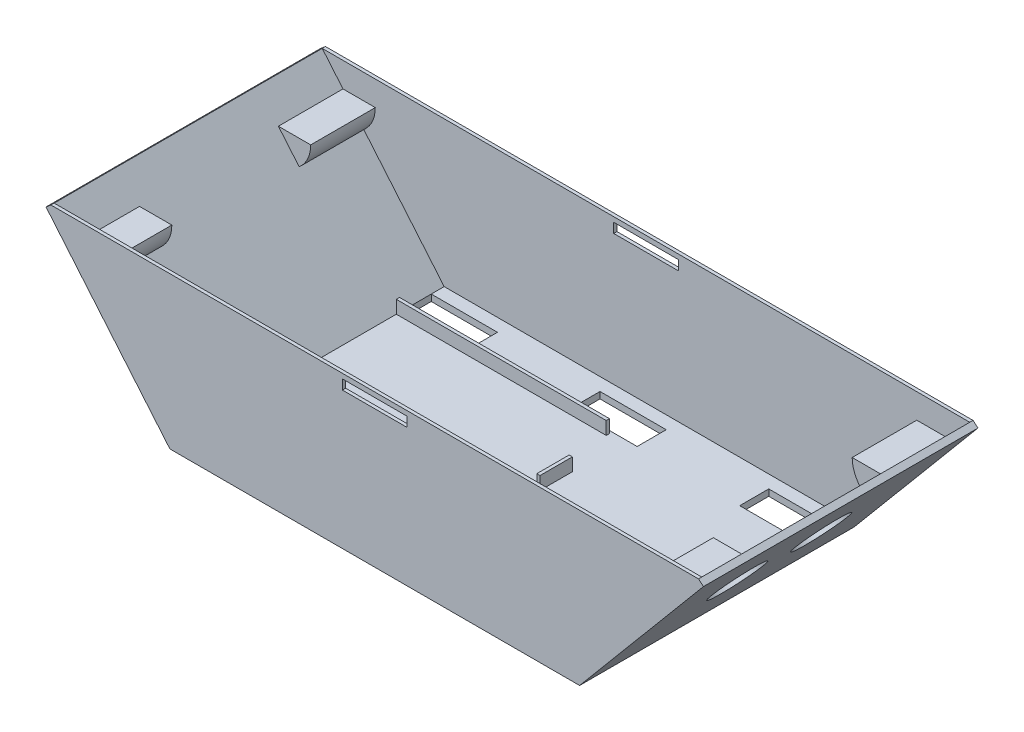
from build123d import *

# Parameters (mm, degrees)
EXTRU_MINCE1_DEPTH      = 85
BOSS_EXTRU_1_DEPTH      = 1
BOSS_EXTRU_2_DEPTH      = 1
ESQUISSE7_W             = 20
ESQUISSE7_H             = 10
R_VOL_MINCE1_ANGLE      = 50
ESQUISSE8_W             = 20
ESQUISSE8_H             = 10
R_VOL_MINCE2_ANGLE      = 50
ESQUISSE9_W             = 20
ESQUISSE9_H             = 10
R_VOL_MINCE3_ANGLE      = 50
ESQUISSE10_W            = 20
ESQUISSE10_H            = 10
R_VOL_MINCE4_ANGLE      = 50
ESQUISSE12_W            = 20.5
ESQUISSE12_H            = 9
ENL_V_MAT_EXTRU_2_DEPTH = 10
ESQUISSE13_W            = 20.5
ESQUISSE13_H            = 9
ENL_V_MAT_EXTRU_3_DEPTH = 10
ESQUISSE14_W            = 65
ESQUISSE14_H            = 1
EXTRU_MINCE2_DEPTH      = 4
ESQUISSE15_W            = 1
ESQUISSE15_H            = 10
EXTRU_MINCE3_DEPTH      = 4
ESQUISSE16_W            = 20
ESQUISSE16_H            = 3
ENL_V_MAT_EXTRU_4_DEPTH = 10
ESQUISSE17_W            = 20
ESQUISSE17_H            = 3
ENL_V_MAT_EXTRU_5_DEPTH = 10
ESQUISSE19_R            = 8.005
ENL_V_MAT_EXTRU_6_DEPTH = 10


with BuildPart() as part:
    # Esquisse3 → Extru.-Mince1 (new body)
    with BuildSketch(Plane.XY):
        Polygon((-37.759483403, 45), (0, 0), (125, 0), (162.759483403, 45), (164.291572289, 43.714424781), (125.932615316, -2), (-0.932615316, -2), (-39.291572289, 43.714424781), align=None)
    extrude(amount=EXTRU_MINCE1_DEPTH)

    # Esquisse5 → Boss.-Extru.1 (add)
    with BuildSketch(Plane(origin=(0, 0, 0), x_dir=(-1, 0, 0), z_dir=(0, 0, -1))):
        Polygon((-162.759483403, 45), (37.759483403, 45), (0, 0), (-125, 0), align=None)
    extrude(amount=-BOSS_EXTRU_1_DEPTH)

    # Esquisse6 → Boss.-Extru.2 (add)
    with BuildSketch(Plane.XY.offset(85)):
        Polygon((162.759483403, 45), (-37.759483403, 45), (0, 0), (125, 0), align=None)
    extrude(amount=-BOSS_EXTRU_2_DEPTH)

    # Esquisse7 → Révol.-Mince1 (revolve)
    with BuildSketch(Plane(origin=(0, 0, 0), x_dir=(0, 0, -1), z_dir=(0.7660444431189791, 0.642787609686538, 0))):
        with Locations((-74, 43.74332802)):
            Rectangle(ESQUISSE7_W, ESQUISSE7_H)
    revolve(axis=Axis((-31.331607306, 37.339555569, 84), (0, 0, 1)), revolution_arc=R_VOL_MINCE1_ANGLE)

    # Esquisse8 → Révol.-Mince2 (revolve)
    with BuildSketch(Plane(origin=(0, 0, 0), x_dir=(0, 0, -1), z_dir=(0.7660444431189791, 0.642787609686538, 0))):
        with Locations((-11, 43.74332802)):
            Rectangle(ESQUISSE8_W, ESQUISSE8_H)
    revolve(axis=Axis((-31.331607306, 37.339555569, 1), (0, 0, 1)), revolution_arc=R_VOL_MINCE2_ANGLE)

    # Esquisse9 → Révol.-Mince3 (revolve)
    with BuildSketch(Plane(origin=(73.353011104, -61.550484563, 0), x_dir=(0, 0, 1), z_dir=(-0.7660444431189796, 0.6427876096865375, 0))):
        with Locations((74, 124.091779231)):
            Rectangle(ESQUISSE9_W, ESQUISSE9_H)
    revolve(axis=Axis((156.331607306, 37.339555569, 84), (0, 0, -1)), revolution_arc=R_VOL_MINCE3_ANGLE)

    # Esquisse10 → Révol.-Mince4 (revolve)
    with BuildSketch(Plane(origin=(73.353011104, -61.550484563, 0), x_dir=(0, 0, 1), z_dir=(-0.7660444431189796, 0.6427876096865375, 0))):
        with Locations((11, 124.091779231)):
            Rectangle(ESQUISSE10_W, ESQUISSE10_H)
    revolve(axis=Axis((156.331607306, 37.339555569, 1), (0, 0, -1)), revolution_arc=R_VOL_MINCE4_ANGLE)

    # Esquisse12 → Enlèv. mat.-Extru.2 (cut)
    with BuildSketch(Plane(origin=(0, 0, 0), x_dir=(1, 0, 0), z_dir=(0, 1, 0))):
        with Locations((10.25, -9.5)):
            Rectangle(ESQUISSE12_W, ESQUISSE12_H)
        with Locations((10.25, -75.5)):
            Rectangle(ESQUISSE12_W, ESQUISSE12_H)
        with Locations((114.75, -9.5)):
            Rectangle(ESQUISSE12_W, ESQUISSE12_H)
        with Locations((114.75, -75.5)):
            Rectangle(ESQUISSE12_W, ESQUISSE12_H)
    extrude(amount=-ENL_V_MAT_EXTRU_2_DEPTH, mode=Mode.SUBTRACT)

    # Esquisse13 → Enlèv. mat.-Extru.3 (cut)
    with BuildSketch(Plane(origin=(0, 0, 0), x_dir=(1, 0, 0), z_dir=(0, 1, 0))):
        with Locations((62.5, -9.5)):
            Rectangle(ESQUISSE13_W, ESQUISSE13_H)
        with Locations((62.5, -75.5)):
            Rectangle(ESQUISSE13_W, ESQUISSE13_H)
    extrude(amount=-ENL_V_MAT_EXTRU_3_DEPTH, mode=Mode.SUBTRACT)

    # Esquisse14 → Extru.-Mince2 (add)
    with BuildSketch(Plane(origin=(0, 0, 0), x_dir=(1, 0, 0), z_dir=(0, 1, 0))):
        with Locations((32.5, -15.319657918)):
            Rectangle(ESQUISSE14_W, ESQUISSE14_H)
        with Locations((32.5, -68.819657918)):
            Rectangle(ESQUISSE14_W, ESQUISSE14_H)
    extrude(amount=EXTRU_MINCE2_DEPTH)

    # Esquisse15 → Extru.-Mince3 (add)
    with BuildSketch(Plane(origin=(0, 0, 0), x_dir=(1, 0, 0), z_dir=(0, 1, 0))):
        with Locations((69, -35.819657918)):
            Rectangle(ESQUISSE15_W, ESQUISSE15_H)
    extrude(amount=EXTRU_MINCE3_DEPTH)

    # Esquisse16 → Enlèv. mat.-Extru.4 (cut)
    with BuildSketch(Plane.XY.offset(1)):
        with Locations((62.5, 42)):
            Rectangle(ESQUISSE16_W, ESQUISSE16_H)
    extrude(amount=-ENL_V_MAT_EXTRU_4_DEPTH, mode=Mode.SUBTRACT)

    # Esquisse17 → Enlèv. mat.-Extru.5 (cut)
    with BuildSketch(Plane(origin=(0, 0, 84), x_dir=(-1, 0, 0), z_dir=(0, 0, -1))):
        with Locations((-62.5, 42)):
            Rectangle(ESQUISSE17_W, ESQUISSE17_H)
    extrude(amount=-ENL_V_MAT_EXTRU_5_DEPTH, mode=Mode.SUBTRACT)

    # Esquisse19 → Enlèv. mat.-Extru.6 (cut)
    with BuildSketch(Plane(origin=(74.88509999, -62.836059783, 0), x_dir=(0, 0, -1), z_dir=(0.7660444431189799, -0.6427876096865373, 0))):
        with Locations(Location((-29.5, 109.415835895, 0), (0, 0, 90))):
            Circle(ESQUISSE19_R)
        with Locations(Location((-55.5, 109.415835895, 0), (0, 0, 90))):
            Circle(ESQUISSE19_R)
    extrude(amount=-ENL_V_MAT_EXTRU_6_DEPTH, mode=Mode.SUBTRACT)


solid = part.part
